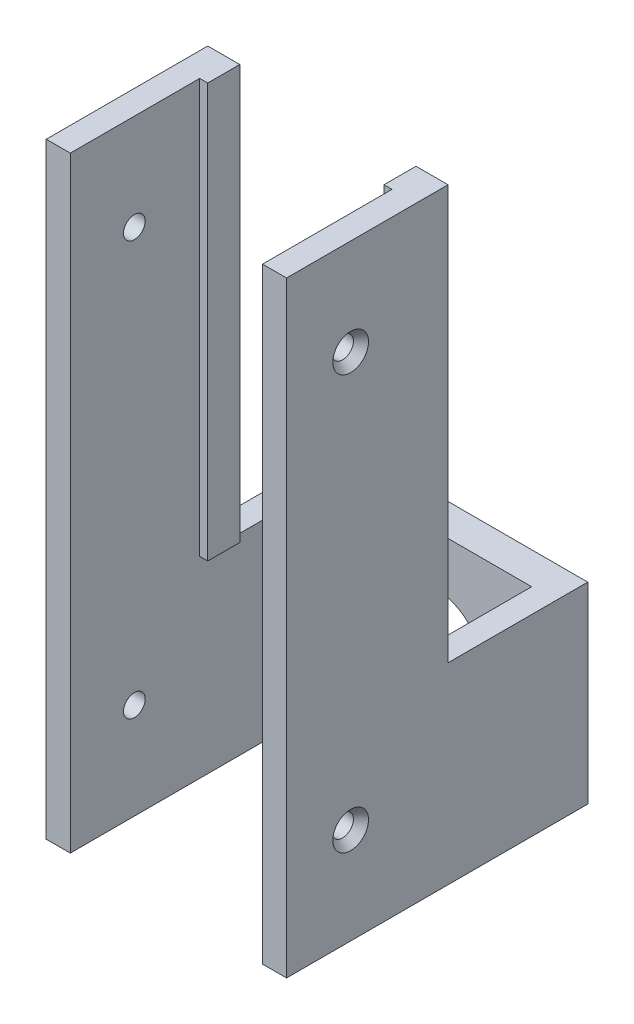
from build123d import *

# Parameters (mm, degrees)
BOSS_EXTRUDE1_DEPTH                            = 38.1
SKETCH7_R                                      = 9.2075
CUT_EXTRUDE2_DEPTH                             = 38.1
SKETCH8_W                                      = 4.7625
SKETCH8_H                                      = 25.654
BOSS_EXTRUDE2_DEPTH                            = 82.042
CSK_FOR_6_FLAT_HEAD_MACHINE_SCREW1_D           = 4.3053
CSK_FOR_6_FLAT_HEAD_MACHINE_SCREW1_DEPTH       = 4.7625
CSK_FOR_6_FLAT_HEAD_MACHINE_SCREW1_CSINK_D     = 7.0866
CSK_FOR_6_FLAT_HEAD_MACHINE_SCREW1_CSINK_ANGLE = 82
CSK_FOR_6_FLAT_HEAD_MACHINE_SCREW2_D           = 4.3053
CSK_FOR_6_FLAT_HEAD_MACHINE_SCREW2_CSINK_D     = 7.0866
CSK_FOR_6_FLAT_HEAD_MACHINE_SCREW2_CSINK_ANGLE = 82
SKETCH9_W                                      = 6.35
SKETCH9_H                                      = 82.042
BOSS_EXTRUDE3_DEPTH                            = 6.35


with BuildPart() as part:
    # Sketch1 → Boss-Extrude1 (new body)
    with BuildSketch(Plane(origin=(0, 0, 0), x_dir=(1, 0, 0), z_dir=(0, 1, 0))):
        Polygon((0, 0), (0, 59.69), (47.625, 59.69), (47.625, 0), (42.8625, 0), (42.8625, 53.34), (4.7625, 53.34), (4.7625, 0), align=None)
    extrude(amount=BOSS_EXTRUDE1_DEPTH)

    # Sketch7 → Cut-Extrude2 (cut)
    with BuildSketch(Plane(origin=(0, 0, -59.69), x_dir=(-1, 0, 0), z_dir=(0, 0, -1))):
        with Locations((-23.8125, 19.05)):
            Circle(SKETCH7_R)
    extrude(amount=-CUT_EXTRUDE2_DEPTH, mode=Mode.SUBTRACT)

    # Sketch8 → Boss-Extrude2 (add)
    with BuildSketch(Plane(origin=(0, 38.1, 0), x_dir=(1, 0, 0), z_dir=(0, 1, 0))):
        with Locations((2.38125, 12.827)):
            Rectangle(SKETCH8_W, SKETCH8_H)
        with Locations((45.24375, 12.827)):
            Rectangle(SKETCH8_W, SKETCH8_H)
    extrude(amount=BOSS_EXTRUDE2_DEPTH)

    # CSK for #6 Flat Head Machine Screw1
    with Locations(Plane.ZY):
        with Locations((-12.7, 19.05), (-12.7, 101.092)):
            CounterSinkHole(CSK_FOR_6_FLAT_HEAD_MACHINE_SCREW1_D / 2, CSK_FOR_6_FLAT_HEAD_MACHINE_SCREW1_CSINK_D / 2, depth=CSK_FOR_6_FLAT_HEAD_MACHINE_SCREW1_DEPTH, counter_sink_angle=CSK_FOR_6_FLAT_HEAD_MACHINE_SCREW1_CSINK_ANGLE)

    # CSK for #6 Flat Head Machine Screw2 (through all)
    with Locations(Plane(origin=(47.625, 0, 0), x_dir=(0, 0, -1), z_dir=(1, 0, 0))):
        with Locations((12.7, 19.05), (12.7, 101.092)):
            CounterSinkHole(CSK_FOR_6_FLAT_HEAD_MACHINE_SCREW2_D / 2, CSK_FOR_6_FLAT_HEAD_MACHINE_SCREW2_CSINK_D / 2, counter_sink_angle=CSK_FOR_6_FLAT_HEAD_MACHINE_SCREW2_CSINK_ANGLE)

    # Sketch9 → Boss-Extrude3 (add)
    with BuildSketch(Plane(origin=(0, 0, -25.654), x_dir=(-1, 0, 0), z_dir=(0, 0, -1))):
        with Locations((-3.175, 79.121)):
            Rectangle(SKETCH9_W, SKETCH9_H)
        with Locations((-44.45, 79.121)):
            Rectangle(SKETCH9_W, SKETCH9_H)
    extrude(amount=BOSS_EXTRUDE3_DEPTH)


solid = part.part
